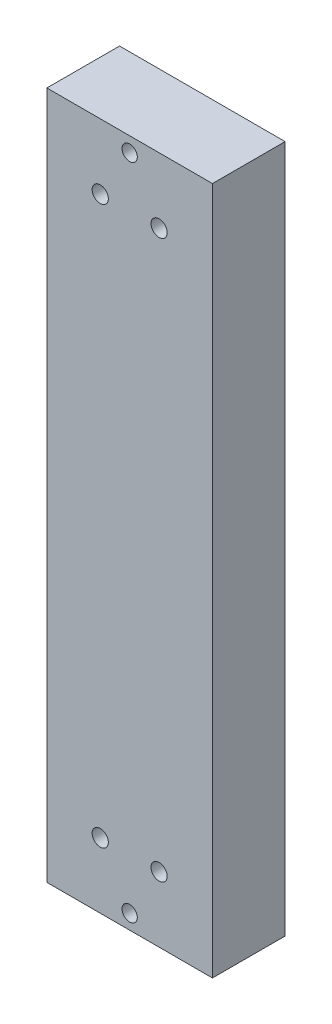
from build123d import *

# Parameters (mm, degrees)
SKETCH1_W           = 45
SKETCH1_H           = 187
SKETCH1_R           = 2.2
SKETCH1_R_2         = 2.075
BOSS_EXTRUDE1_DEPTH = 4.75
BOSS_EXTRUDE2_START = -15
SKETCH1_3_R         = 2.075
SKETCH1_3_W         = 2
SKETCH1_3_H         = 171
SKETCH1_3_W_2       = 3
BOSS_EXTRUDE2_DEPTH = 15


with BuildPart() as part:
    # Sketch1 → Boss-Extrude1 (new body)
    with BuildSketch(Plane.XY):
        with Locations((8, 0)):
            Rectangle(SKETCH1_W, SKETCH1_H)
        with Locations((0, -75.75)):
            Circle(SKETCH1_R, mode=Mode.SUBTRACT)
        with Locations((16, -75.75)):
            Circle(SKETCH1_R, mode=Mode.SUBTRACT)
        with Locations((0, 75.75)):
            Circle(SKETCH1_R, mode=Mode.SUBTRACT)
        with Locations((16, 75.75)):
            Circle(SKETCH1_R, mode=Mode.SUBTRACT)
        with Locations((8, -89.5)):
            Circle(SKETCH1_R_2, mode=Mode.SUBTRACT)
        with Locations(Location((8, 89.5, 0), (0, 0, 180))):
            Circle(SKETCH1_R_2, mode=Mode.SUBTRACT)
    extrude(amount=BOSS_EXTRUDE1_DEPTH)

    # Sketch1<3> → Boss-Extrude2 (add)
    # profile 1 of 5: a face of its own
    with BuildSketch(Plane.XY.offset(BOSS_EXTRUDE2_START)):
        Polygon((-12.5, 85.5), (-6.5, 85.5), (6.5, 85.5), (9.5, 85.5), (22.5, 85.5), (28.5, 85.5), (30.5, 85.5), (30.5, 93.5), (-14.5, 93.5), (-14.5, 85.5), align=None)
        with Locations(Location((8, 89.5, 0), (0, 0, 180))):
            Circle(SKETCH1_3_R, mode=Mode.SUBTRACT)
    # profile 2 of 5: a face of its own
    with BuildSketch(Plane.XY.offset(BOSS_EXTRUDE2_START)):
        with Locations((-13.5, 0)):
            Rectangle(SKETCH1_3_W, SKETCH1_3_H)
    # profile 3 of 5: a face of its own
    with BuildSketch(Plane.XY.offset(BOSS_EXTRUDE2_START)):
        Polygon((6.5, -85.5), (-6.5, -85.5), (-12.5, -85.5), (-14.5, -85.5), (-14.5, -93.5), (30.5, -93.5), (30.5, -85.5), (28.5, -85.5), (22.5, -85.5), (9.5, -85.5), align=None)
        with Locations(Location((8, -89.5, 0), (0, 0, 270))):
            Circle(SKETCH1_3_R, mode=Mode.SUBTRACT)
    # profile 4 of 5: a face of its own
    with BuildSketch(Plane.XY.offset(BOSS_EXTRUDE2_START)):
        with Locations((29.5, 0)):
            Rectangle(SKETCH1_3_W, SKETCH1_3_H)
    # profile 5 of 5: a face of its own
    with BuildSketch(Plane.XY.offset(BOSS_EXTRUDE2_START)):
        with Locations((8, 0)):
            Rectangle(SKETCH1_3_W_2, SKETCH1_3_H)
    extrude(amount=BOSS_EXTRUDE2_DEPTH)


solid = part.part
